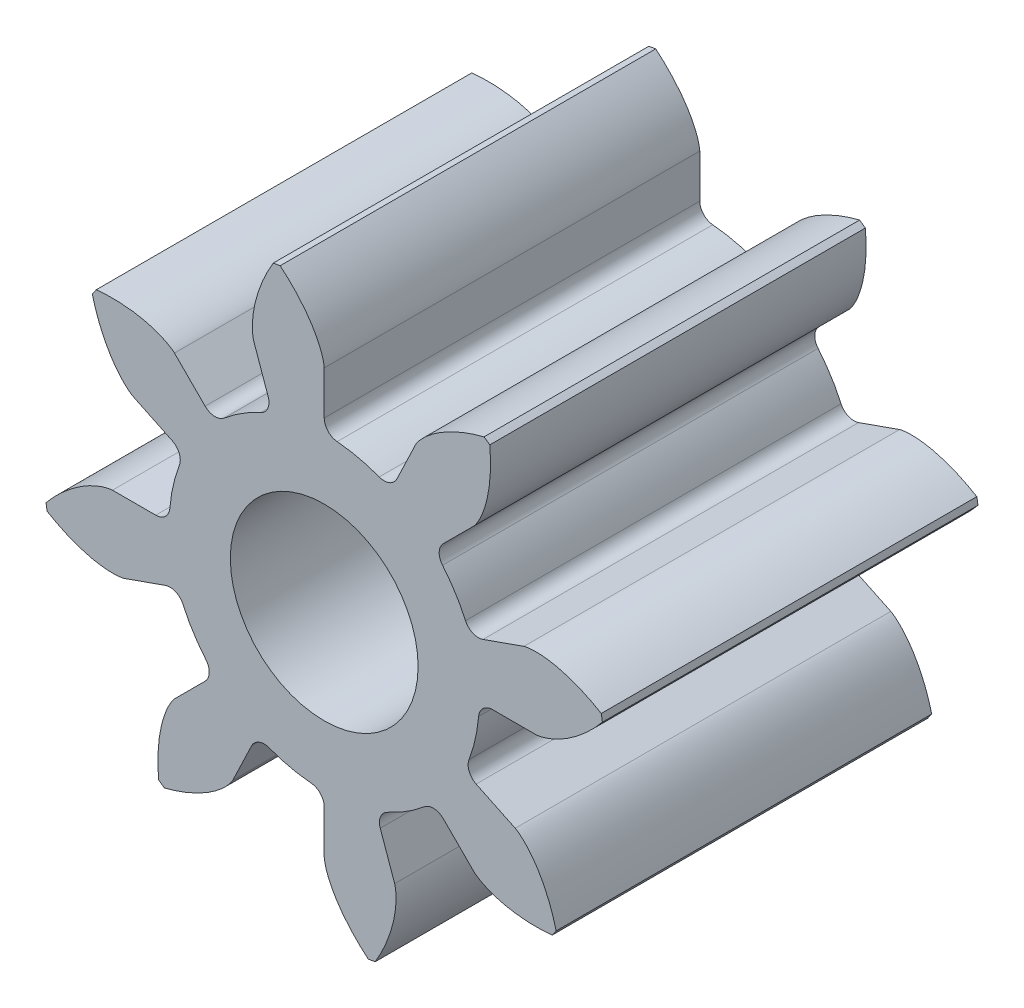
from build123d import *

# Parameters (mm, degrees)
BOSS_EXTRUDE3_DEPTH      = 2
FILLET1_R                = 0.075
CIRPATTERN8_COUNT        = 8
CIRPATTERN8_COPY_1_DEPTH = 2
CIRPATTERN8_COPY_2_DEPTH = 2
CIRPATTERN8_COPY_3_DEPTH = 2
CIRPATTERN8_COPY_4_DEPTH = 2
CIRPATTERN8_COPY_5_DEPTH = 2
CIRPATTERN8_COPY_6_DEPTH = 2
CIRPATTERN8_COPY_7_DEPTH = 2
FILLET1_OF_CIRPATTERN8_R = 0.075
SKETCH3_R                = 0.5
CUT_EXTRUDE2_DEPTH       = 3.896521896


with BuildPart() as part:
    # Sketch1 → Boss-Extrude3 (new body)
    with BuildSketch(Plane.XY):
        with BuildLine():
            Line((0.825, 0), (1.127631145, 0))
            add(Edge.make_bspline(
                [(1.127631145, 0), (1.128464806, 1.7642e-05), (1.1308012, 0.000121717), (1.135208509, 0.000533963), (1.142370428, 0.001511626), (1.151440497, 0.003203779), (1.163077852, 0.005900218), (1.176656111, 0.009726973), (1.191414985, 0.014607522), (1.20726939, 0.020637405), (1.22288705, 0.0272833), (1.238262224, 0.034491791), (1.253382118, 0.042190277), (1.271445997, 0.052117585), (1.292744398, 0.06485338), (1.317061509, 0.080922615), (1.343920408, 0.10052334), (1.370455727, 0.121922447), (1.395854928, 0.144134569), (1.42063721, 0.167852441), (1.443986182, 0.191702496), (1.462469354, 0.212356677), (1.474232419, 0.225969555), (1.480575522, 0.233551685), (1.48152592, 0.234693306)],
                knots=[0, 0, 0, 0, 0, 0.005376748, 0.015083688, 0.02853182, 0.046610139, 0.064854849, 0.092110525, 0.119476175, 0.146842495, 0.174208853, 0.201574955, 0.228941013, 0.256307345, 0.307035032, 0.361767351, 0.41649966, 0.471231936, 0.525964281, 0.580696615, 0.635428982, 0.690161387, 0.699805907, 0.699805907, 0.699805907, 0.699805907, 0.699805907], degree=4))
            ThreePointArc((1.48152592, 0.234693306), (1.480032799, 0.24393219), (1.478482065, 0.253161578))
            Line((1.478482065, 0.253161578), (0.813165135, 0.139238868))
            ThreePointArc((0.813165135, 0.139238868), (0.822035959, 0.069870463), (0.825, 0))
        make_face()
        with BuildLine():
            ThreePointArc((-0.813165135, -0.139238868), (0.069870463, -0.822035959), (0.825, 0))
            ThreePointArc((0.825, 0), (0.822035959, 0.069870463), (0.813165135, 0.139238868))
            Line((0.813165135, 0.139238868), (-0.813165135, -0.139238868))
        make_face()
        with BuildLine():
            Line((-0.813165135, -0.139238868), (0.813165135, 0.139238868))
            ThreePointArc((0.813165135, 0.139238868), (-0.139238868, 0.813165135), (-0.813165135, -0.139238868))
        make_face()
    boss_extrude3 = extrude(amount=BOSS_EXTRUDE3_DEPTH)

    # Mirror2: Boss-Extrude3 across plane
    add(boss_extrude3.mirror(Plane(origin=(0, 0, 2), x_dir=(0, 0, 1), z_dir=(0.16877438565646677, -0.9856547096961908, 0))))

    # Fillet1
    fillet1_edges = [part.edges().sort_by_distance(p)[0] for p in [
        (0.825, 0, 1),
        (0.778000091, 0.274482892, 1),
    ]]
    fillet(fillet1_edges, radius=FILLET1_R)

    # CirPattern8: Boss-Extrude3 ×8 about axis
    cirpattern8_axis = Axis((0, 0, 2), (0, 0, -1))
    for i in range(1, CIRPATTERN8_COUNT):
        add(boss_extrude3.rotate(cirpattern8_axis, i * 360 / CIRPATTERN8_COUNT))

    # CirPattern8 copy 1 sketch → CirPattern8 copy 1 (add)
    with BuildSketch(Plane(origin=(0, 0, 0), x_dir=(0.9020822481355595, -0.4315641523559328, 0), z_dir=(0, 0, 1))):
        with BuildLine():
            Line((0.825, 0), (1.127631145, 0))
            add(Edge.make_bspline(
                [(1.127631145, 0), (1.128464806, -1.7642e-05), (1.1308012, -0.000121717), (1.135208509, -0.000533963), (1.142370428, -0.001511626), (1.151440497, -0.003203779), (1.163077852, -0.005900218), (1.176656111, -0.009726973), (1.191414985, -0.014607522), (1.20726939, -0.020637405), (1.22288705, -0.0272833), (1.238262224, -0.034491791), (1.253382118, -0.042190277), (1.271445997, -0.052117585), (1.292744398, -0.06485338), (1.317061509, -0.080922615), (1.343920408, -0.10052334), (1.370455727, -0.121922447), (1.395854928, -0.144134569), (1.42063721, -0.167852441), (1.443986182, -0.191702496), (1.462469354, -0.212356677), (1.474232419, -0.225969555), (1.480575522, -0.233551685), (1.48152592, -0.234693306)],
                knots=[0, 0, 0, 0, 0, 0.005376748, 0.015083688, 0.02853182, 0.046610139, 0.064854849, 0.092110525, 0.119476175, 0.146842495, 0.174208853, 0.201574955, 0.228941013, 0.256307345, 0.307035032, 0.361767351, 0.41649966, 0.471231936, 0.525964281, 0.580696615, 0.635428982, 0.690161387, 0.699805907, 0.699805907, 0.699805907, 0.699805907, 0.699805907], degree=4))
            ThreePointArc((1.48152592, -0.234693306), (1.480032799, -0.24393219), (1.478482065, -0.253161578))
            Line((1.478482065, -0.253161578), (0.813165135, -0.139238868))
            ThreePointArc((0.813165135, -0.139238868), (0.822035959, -0.069870463), (0.825, 0))
        make_face()
        with BuildLine():
            ThreePointArc((-0.813165135, 0.139238868), (0.069870463, 0.822035959), (0.825, 0))
            ThreePointArc((0.825, 0), (0.822035959, -0.069870463), (0.813165135, -0.139238868))
            Line((0.813165135, -0.139238868), (-0.813165135, 0.139238868))
        make_face()
        with BuildLine():
            Line((-0.813165135, 0.139238868), (0.813165135, -0.139238868))
            ThreePointArc((0.813165135, -0.139238868), (-0.139238868, -0.813165135), (-0.813165135, 0.139238868))
        make_face()
    extrude(amount=CIRPATTERN8_COPY_1_DEPTH)

    # CirPattern8 copy 2 sketch → CirPattern8 copy 2 (add)
    with BuildSketch(Plane(origin=(0, 0, 0), x_dir=(0.3327065361967555, -0.9430304134925644, 0), z_dir=(0, 0, 1))):
        with BuildLine():
            Line((0.825, 0), (1.127631145, 0))
            add(Edge.make_bspline(
                [(1.127631145, 0), (1.128464806, -1.7642e-05), (1.1308012, -0.000121717), (1.135208509, -0.000533963), (1.142370428, -0.001511626), (1.151440497, -0.003203779), (1.163077852, -0.005900218), (1.176656111, -0.009726973), (1.191414985, -0.014607522), (1.20726939, -0.020637405), (1.22288705, -0.0272833), (1.238262224, -0.034491791), (1.253382118, -0.042190277), (1.271445997, -0.052117585), (1.292744398, -0.06485338), (1.317061509, -0.080922615), (1.343920408, -0.10052334), (1.370455727, -0.121922447), (1.395854928, -0.144134569), (1.42063721, -0.167852441), (1.443986182, -0.191702496), (1.462469354, -0.212356677), (1.474232419, -0.225969555), (1.480575522, -0.233551685), (1.48152592, -0.234693306)],
                knots=[0, 0, 0, 0, 0, 0.005376748, 0.015083688, 0.02853182, 0.046610139, 0.064854849, 0.092110525, 0.119476175, 0.146842495, 0.174208853, 0.201574955, 0.228941013, 0.256307345, 0.307035032, 0.361767351, 0.41649966, 0.471231936, 0.525964281, 0.580696615, 0.635428982, 0.690161387, 0.699805907, 0.699805907, 0.699805907, 0.699805907, 0.699805907], degree=4))
            ThreePointArc((1.48152592, -0.234693306), (1.480032799, -0.24393219), (1.478482065, -0.253161578))
            Line((1.478482065, -0.253161578), (0.813165135, -0.139238868))
            ThreePointArc((0.813165135, -0.139238868), (0.822035959, -0.069870463), (0.825, 0))
        make_face()
        with BuildLine():
            ThreePointArc((-0.813165135, 0.139238868), (0.069870463, 0.822035959), (0.825, 0))
            ThreePointArc((0.825, 0), (0.822035959, -0.069870463), (0.813165135, -0.139238868))
            Line((0.813165135, -0.139238868), (-0.813165135, 0.139238868))
        make_face()
        with BuildLine():
            Line((-0.813165135, 0.139238868), (0.813165135, -0.139238868))
            ThreePointArc((0.813165135, -0.139238868), (-0.139238868, -0.813165135), (-0.813165135, 0.139238868))
        make_face()
    extrude(amount=CIRPATTERN8_COPY_2_DEPTH)

    # CirPattern8 copy 3 sketch → CirPattern8 copy 3 (add)
    with BuildSketch(Plane(origin=(0, 0, 0), x_dir=(-0.4315641523559328, -0.9020822481355595, 0), z_dir=(0, 0, 1))):
        with BuildLine():
            Line((0.825, 0), (1.127631145, 0))
            add(Edge.make_bspline(
                [(1.127631145, 0), (1.128464806, -1.7642e-05), (1.1308012, -0.000121717), (1.135208509, -0.000533963), (1.142370428, -0.001511626), (1.151440497, -0.003203779), (1.163077852, -0.005900218), (1.176656111, -0.009726973), (1.191414985, -0.014607522), (1.20726939, -0.020637405), (1.22288705, -0.0272833), (1.238262224, -0.034491791), (1.253382118, -0.042190277), (1.271445997, -0.052117585), (1.292744398, -0.06485338), (1.317061509, -0.080922615), (1.343920408, -0.10052334), (1.370455727, -0.121922447), (1.395854928, -0.144134569), (1.42063721, -0.167852441), (1.443986182, -0.191702496), (1.462469354, -0.212356677), (1.474232419, -0.225969555), (1.480575522, -0.233551685), (1.48152592, -0.234693306)],
                knots=[0, 0, 0, 0, 0, 0.005376748, 0.015083688, 0.02853182, 0.046610139, 0.064854849, 0.092110525, 0.119476175, 0.146842495, 0.174208853, 0.201574955, 0.228941013, 0.256307345, 0.307035032, 0.361767351, 0.41649966, 0.471231936, 0.525964281, 0.580696615, 0.635428982, 0.690161387, 0.699805907, 0.699805907, 0.699805907, 0.699805907, 0.699805907], degree=4))
            ThreePointArc((1.48152592, -0.234693306), (1.480032799, -0.24393219), (1.478482065, -0.253161578))
            Line((1.478482065, -0.253161578), (0.813165135, -0.139238868))
            ThreePointArc((0.813165135, -0.139238868), (0.822035959, -0.069870463), (0.825, 0))
        make_face()
        with BuildLine():
            ThreePointArc((-0.813165135, 0.139238868), (0.069870463, 0.822035959), (0.825, 0))
            ThreePointArc((0.825, 0), (0.822035959, -0.069870463), (0.813165135, -0.139238868))
            Line((0.813165135, -0.139238868), (-0.813165135, 0.139238868))
        make_face()
        with BuildLine():
            Line((-0.813165135, 0.139238868), (0.813165135, -0.139238868))
            ThreePointArc((0.813165135, -0.139238868), (-0.139238868, -0.813165135), (-0.813165135, 0.139238868))
        make_face()
    extrude(amount=CIRPATTERN8_COPY_3_DEPTH)

    # CirPattern8 copy 4 sketch → CirPattern8 copy 4 (add)
    with BuildSketch(Plane(origin=(0, 0, 0), x_dir=(-0.9430304134925644, -0.33270653619675555, 0), z_dir=(0, 0, 1))):
        with BuildLine():
            Line((0.825, 0), (1.127631145, 0))
            add(Edge.make_bspline(
                [(1.127631145, 0), (1.128464806, -1.7642e-05), (1.1308012, -0.000121717), (1.135208509, -0.000533963), (1.142370428, -0.001511626), (1.151440497, -0.003203779), (1.163077852, -0.005900218), (1.176656111, -0.009726973), (1.191414985, -0.014607522), (1.20726939, -0.020637405), (1.22288705, -0.0272833), (1.238262224, -0.034491791), (1.253382118, -0.042190277), (1.271445997, -0.052117585), (1.292744398, -0.06485338), (1.317061509, -0.080922615), (1.343920408, -0.10052334), (1.370455727, -0.121922447), (1.395854928, -0.144134569), (1.42063721, -0.167852441), (1.443986182, -0.191702496), (1.462469354, -0.212356677), (1.474232419, -0.225969555), (1.480575522, -0.233551685), (1.48152592, -0.234693306)],
                knots=[0, 0, 0, 0, 0, 0.005376748, 0.015083688, 0.02853182, 0.046610139, 0.064854849, 0.092110525, 0.119476175, 0.146842495, 0.174208853, 0.201574955, 0.228941013, 0.256307345, 0.307035032, 0.361767351, 0.41649966, 0.471231936, 0.525964281, 0.580696615, 0.635428982, 0.690161387, 0.699805907, 0.699805907, 0.699805907, 0.699805907, 0.699805907], degree=4))
            ThreePointArc((1.48152592, -0.234693306), (1.480032799, -0.24393219), (1.478482065, -0.253161578))
            Line((1.478482065, -0.253161578), (0.813165135, -0.139238868))
            ThreePointArc((0.813165135, -0.139238868), (0.822035959, -0.069870463), (0.825, 0))
        make_face()
        with BuildLine():
            ThreePointArc((-0.813165135, 0.139238868), (0.069870463, 0.822035959), (0.825, 0))
            ThreePointArc((0.825, 0), (0.822035959, -0.069870463), (0.813165135, -0.139238868))
            Line((0.813165135, -0.139238868), (-0.813165135, 0.139238868))
        make_face()
        with BuildLine():
            Line((-0.813165135, 0.139238868), (0.813165135, -0.139238868))
            ThreePointArc((0.813165135, -0.139238868), (-0.139238868, -0.813165135), (-0.813165135, 0.139238868))
        make_face()
    extrude(amount=CIRPATTERN8_COPY_4_DEPTH)

    # CirPattern8 copy 5 sketch → CirPattern8 copy 5 (add)
    with BuildSketch(Plane(origin=(0, 0, 0), x_dir=(-0.9020822481355597, 0.4315641523559328, 0), z_dir=(0, 0, 1))):
        with BuildLine():
            Line((0.825, 0), (1.127631145, 0))
            add(Edge.make_bspline(
                [(1.127631145, 0), (1.128464806, -1.7642e-05), (1.1308012, -0.000121717), (1.135208509, -0.000533963), (1.142370428, -0.001511626), (1.151440497, -0.003203779), (1.163077852, -0.005900218), (1.176656111, -0.009726973), (1.191414985, -0.014607522), (1.20726939, -0.020637405), (1.22288705, -0.0272833), (1.238262224, -0.034491791), (1.253382118, -0.042190277), (1.271445997, -0.052117585), (1.292744398, -0.06485338), (1.317061509, -0.080922615), (1.343920408, -0.10052334), (1.370455727, -0.121922447), (1.395854928, -0.144134569), (1.42063721, -0.167852441), (1.443986182, -0.191702496), (1.462469354, -0.212356677), (1.474232419, -0.225969555), (1.480575522, -0.233551685), (1.48152592, -0.234693306)],
                knots=[0, 0, 0, 0, 0, 0.005376748, 0.015083688, 0.02853182, 0.046610139, 0.064854849, 0.092110525, 0.119476175, 0.146842495, 0.174208853, 0.201574955, 0.228941013, 0.256307345, 0.307035032, 0.361767351, 0.41649966, 0.471231936, 0.525964281, 0.580696615, 0.635428982, 0.690161387, 0.699805907, 0.699805907, 0.699805907, 0.699805907, 0.699805907], degree=4))
            ThreePointArc((1.48152592, -0.234693306), (1.480032799, -0.24393219), (1.478482065, -0.253161578))
            Line((1.478482065, -0.253161578), (0.813165135, -0.139238868))
            ThreePointArc((0.813165135, -0.139238868), (0.822035959, -0.069870463), (0.825, 0))
        make_face()
        with BuildLine():
            ThreePointArc((-0.813165135, 0.139238868), (0.069870463, 0.822035959), (0.825, 0))
            ThreePointArc((0.825, 0), (0.822035959, -0.069870463), (0.813165135, -0.139238868))
            Line((0.813165135, -0.139238868), (-0.813165135, 0.139238868))
        make_face()
        with BuildLine():
            Line((-0.813165135, 0.139238868), (0.813165135, -0.139238868))
            ThreePointArc((0.813165135, -0.139238868), (-0.139238868, -0.813165135), (-0.813165135, 0.139238868))
        make_face()
    extrude(amount=CIRPATTERN8_COPY_5_DEPTH)

    # CirPattern8 copy 6 sketch → CirPattern8 copy 6 (add)
    with BuildSketch(Plane(origin=(0, 0, 0), x_dir=(-0.3327065361967556, 0.9430304134925643, 0), z_dir=(0, 0, 1))):
        with BuildLine():
            Line((0.825, 0), (1.127631145, 0))
            add(Edge.make_bspline(
                [(1.127631145, 0), (1.128464806, -1.7642e-05), (1.1308012, -0.000121717), (1.135208509, -0.000533963), (1.142370428, -0.001511626), (1.151440497, -0.003203779), (1.163077852, -0.005900218), (1.176656111, -0.009726973), (1.191414985, -0.014607522), (1.20726939, -0.020637405), (1.22288705, -0.0272833), (1.238262224, -0.034491791), (1.253382118, -0.042190277), (1.271445997, -0.052117585), (1.292744398, -0.06485338), (1.317061509, -0.080922615), (1.343920408, -0.10052334), (1.370455727, -0.121922447), (1.395854928, -0.144134569), (1.42063721, -0.167852441), (1.443986182, -0.191702496), (1.462469354, -0.212356677), (1.474232419, -0.225969555), (1.480575522, -0.233551685), (1.48152592, -0.234693306)],
                knots=[0, 0, 0, 0, 0, 0.005376748, 0.015083688, 0.02853182, 0.046610139, 0.064854849, 0.092110525, 0.119476175, 0.146842495, 0.174208853, 0.201574955, 0.228941013, 0.256307345, 0.307035032, 0.361767351, 0.41649966, 0.471231936, 0.525964281, 0.580696615, 0.635428982, 0.690161387, 0.699805907, 0.699805907, 0.699805907, 0.699805907, 0.699805907], degree=4))
            ThreePointArc((1.48152592, -0.234693306), (1.480032799, -0.24393219), (1.478482065, -0.253161578))
            Line((1.478482065, -0.253161578), (0.813165135, -0.139238868))
            ThreePointArc((0.813165135, -0.139238868), (0.822035959, -0.069870463), (0.825, 0))
        make_face()
        with BuildLine():
            ThreePointArc((-0.813165135, 0.139238868), (0.069870463, 0.822035959), (0.825, 0))
            ThreePointArc((0.825, 0), (0.822035959, -0.069870463), (0.813165135, -0.139238868))
            Line((0.813165135, -0.139238868), (-0.813165135, 0.139238868))
        make_face()
        with BuildLine():
            Line((-0.813165135, 0.139238868), (0.813165135, -0.139238868))
            ThreePointArc((0.813165135, -0.139238868), (-0.139238868, -0.813165135), (-0.813165135, 0.139238868))
        make_face()
    extrude(amount=CIRPATTERN8_COPY_6_DEPTH)

    # CirPattern8 copy 7 sketch → CirPattern8 copy 7 (add)
    with BuildSketch(Plane(origin=(0, 0, 0), x_dir=(0.4315641523559327, 0.9020822481355596, 0), z_dir=(0, 0, 1))):
        with BuildLine():
            Line((0.825, 0), (1.127631145, 0))
            add(Edge.make_bspline(
                [(1.127631145, 0), (1.128464806, -1.7642e-05), (1.1308012, -0.000121717), (1.135208509, -0.000533963), (1.142370428, -0.001511626), (1.151440497, -0.003203779), (1.163077852, -0.005900218), (1.176656111, -0.009726973), (1.191414985, -0.014607522), (1.20726939, -0.020637405), (1.22288705, -0.0272833), (1.238262224, -0.034491791), (1.253382118, -0.042190277), (1.271445997, -0.052117585), (1.292744398, -0.06485338), (1.317061509, -0.080922615), (1.343920408, -0.10052334), (1.370455727, -0.121922447), (1.395854928, -0.144134569), (1.42063721, -0.167852441), (1.443986182, -0.191702496), (1.462469354, -0.212356677), (1.474232419, -0.225969555), (1.480575522, -0.233551685), (1.48152592, -0.234693306)],
                knots=[0, 0, 0, 0, 0, 0.005376748, 0.015083688, 0.02853182, 0.046610139, 0.064854849, 0.092110525, 0.119476175, 0.146842495, 0.174208853, 0.201574955, 0.228941013, 0.256307345, 0.307035032, 0.361767351, 0.41649966, 0.471231936, 0.525964281, 0.580696615, 0.635428982, 0.690161387, 0.699805907, 0.699805907, 0.699805907, 0.699805907, 0.699805907], degree=4))
            ThreePointArc((1.48152592, -0.234693306), (1.480032799, -0.24393219), (1.478482065, -0.253161578))
            Line((1.478482065, -0.253161578), (0.813165135, -0.139238868))
            ThreePointArc((0.813165135, -0.139238868), (0.822035959, -0.069870463), (0.825, 0))
        make_face()
        with BuildLine():
            ThreePointArc((-0.813165135, 0.139238868), (0.069870463, 0.822035959), (0.825, 0))
            ThreePointArc((0.825, 0), (0.822035959, -0.069870463), (0.813165135, -0.139238868))
            Line((0.813165135, -0.139238868), (-0.813165135, 0.139238868))
        make_face()
        with BuildLine():
            Line((-0.813165135, 0.139238868), (0.813165135, -0.139238868))
            ThreePointArc((0.813165135, -0.139238868), (-0.139238868, -0.813165135), (-0.813165135, 0.139238868))
        make_face()
    extrude(amount=CIRPATTERN8_COPY_7_DEPTH)

    # Fillet1 of CirPattern8
    fillet1_of_cirpattern8_edges = [part.edges().sort_by_distance(p)[0] for p in [
        (0.583363094, -0.583363094, 1),
        (0.744217855, -0.356040426, 1),
        (0, -0.825, 1),
        (0.274482892, -0.778000091, 1),
        (-0.583363094, -0.583363094, 1),
        (-0.356040426, -0.744217855, 1),
        (-0.825, 0, 1),
        (-0.778000091, -0.274482892, 1),
        (-0.583363094, 0.583363094, 1),
        (-0.744217855, 0.356040426, 1),
        (0, 0.825, 1),
        (-0.274482892, 0.778000091, 1),
        (0.583363094, 0.583363094, 1),
        (0.356040426, 0.744217855, 1),
    ]]
    fillet(fillet1_of_cirpattern8_edges, radius=FILLET1_OF_CIRPATTERN8_R)

    # Sketch3 → Cut-Extrude2 (cut, through all)
    with BuildSketch(Plane.XY.offset(2)):
        Circle(SKETCH3_R)
    extrude(amount=-CUT_EXTRUDE2_DEPTH, mode=Mode.SUBTRACT)


solid = part.part
